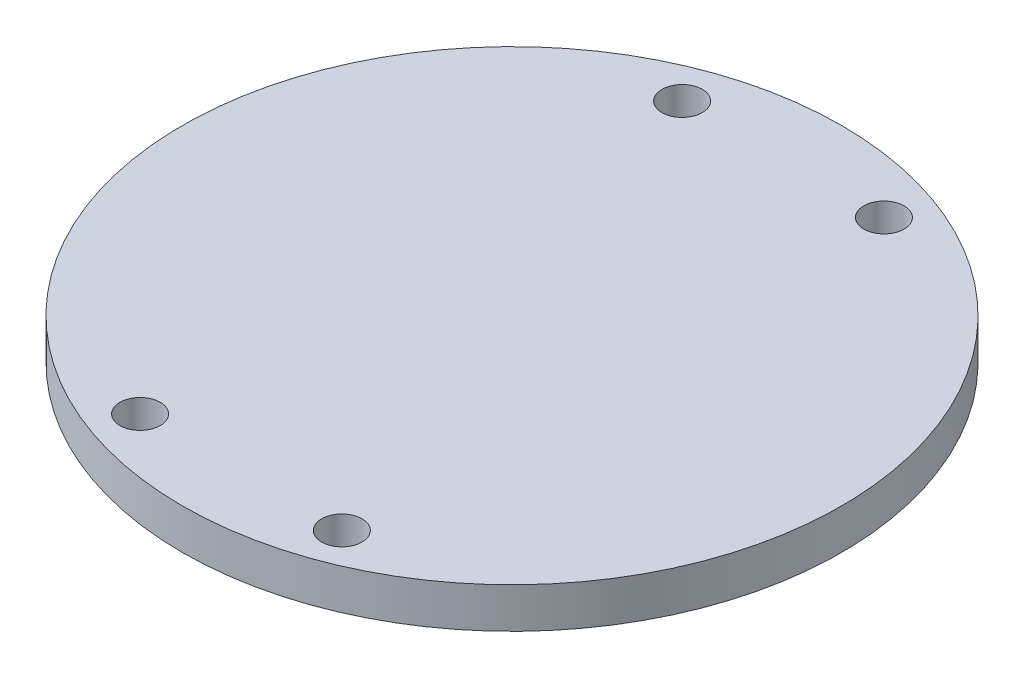
from build123d import *

# Parameters (mm, degrees)
SKETCH1_R           = 49
BOSS_EXTRUDE1_DEPTH = 6
SKETCH2_R           = 3
CUT_EXTRUDE2_DEPTH  = 6


with BuildPart() as part:
    # Sketch1 → Boss-Extrude1 (new body)
    with BuildSketch(Plane(origin=(0, 0, 0), x_dir=(1, 0, 0), z_dir=(0, 1, 0))):
        with Locations(Location((0, 0, 0), (0, 0, 270))):
            Circle(SKETCH1_R)
    extrude(amount=BOSS_EXTRUDE1_DEPTH)

    # Sketch2 → Cut-Extrude2 (cut)
    with BuildSketch(Plane(origin=(0, 6, 0), x_dir=(1, 0, 0), z_dir=(0, 1, 0))):
        with Locations(Location((-15, 40.298883359, 0), (0, 0, 270))):
            Circle(SKETCH2_R)
        with Locations(Location((15, 40.298883359, 0), (0, 0, 270))):
            Circle(SKETCH2_R)
        with Locations(Location((-15, -40.298883359, 0), (0, 0, 270))):
            Circle(SKETCH2_R)
        with Locations(Location((15, -40.298883359, 0), (0, 0, 270))):
            Circle(SKETCH2_R)
    extrude(amount=-CUT_EXTRUDE2_DEPTH, mode=Mode.SUBTRACT)


solid = part.part
